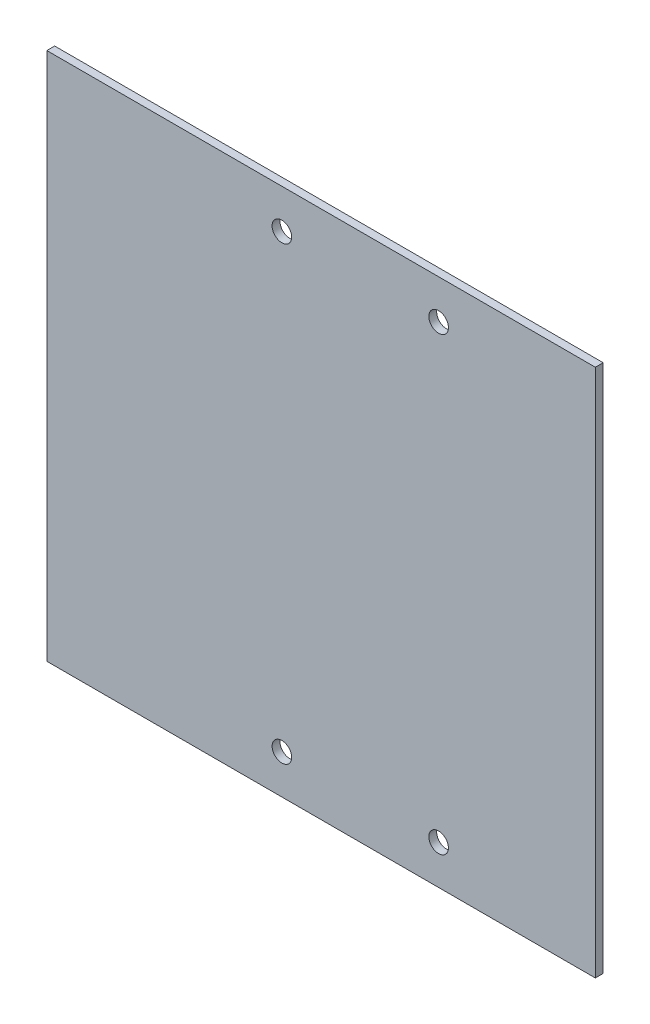
from build123d import *

# Parameters (mm, degrees)
IZIM1_W                     = 140
IZIM1_H                     = 135
IZIM1_R                     = 2.5
Y_KSEKLIK_EKSTR_ZYON1_DEPTH = 2


with BuildPart() as part:
    # Çizim1 → Yükseklik-Ekstrüzyon1 (new body)
    with BuildSketch(Plane.XY):
        with Locations((70, 67.5)):
            Rectangle(IZIM1_W, IZIM1_H)
        with Locations((60, 125)):
            Circle(IZIM1_R, mode=Mode.SUBTRACT)
        with Locations((100, 125)):
            Circle(IZIM1_R, mode=Mode.SUBTRACT)
        with Locations((60, 10)):
            Circle(IZIM1_R, mode=Mode.SUBTRACT)
        with Locations((100, 10)):
            Circle(IZIM1_R, mode=Mode.SUBTRACT)
    extrude(amount=Y_KSEKLIK_EKSTR_ZYON1_DEPTH)


solid = part.part
